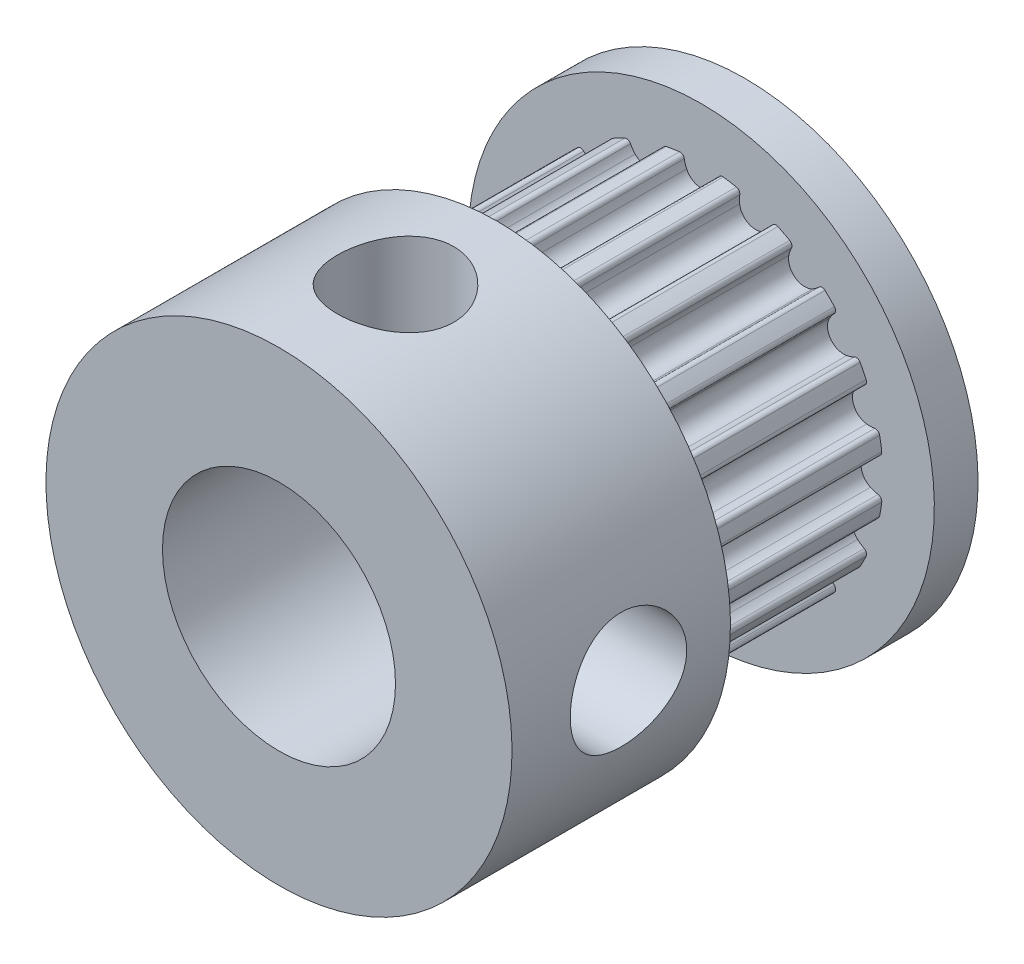
from build123d import *

# Parameters (mm, degrees)
CROQUIS1_R              = 6.366
SALIENTE_EXTRUIR1_DEPTH = 7
CORTAR_EXTRUIR1_DEPTH   = 12.404030516
MATRIZC1_COUNT          = 20
CROQUIS5_W              = 1.5
CROQUIS5_H              = 8
CROQUIS5_W_2            = 7.5
CROQUIS6_R              = 4
CORTAR_EXTRUIR2_DEPTH   = 20.595917942
CROQUIS8_R              = 2
CORTAR_EXTRUIR3_DEPTH   = 19.391574158
CROQUIS9_R              = 2
CORTAR_EXTRUIR4_DEPTH   = 19.391574324


with BuildPart() as part:
    # Croquis1 → Saliente-Extruir1 (new body)
    with BuildSketch(Plane.XY):
        Circle(CROQUIS1_R)
    extrude(amount=SALIENTE_EXTRUIR1_DEPTH)

    # Croquis3 → Cortar-Extruir1 (cut, through all)
    with BuildSketch(Plane(origin=(0, 0, 0), x_dir=(-1, 0, 0), z_dir=(0, 0, -1))):
        with BuildLine():
            Line((-7.140411071, 45.082781216), (-0.995861804, 6.287623976))
            Line((-0.995861804, 6.287623976), (-0.975994627, 6.162187557))
            ThreePointArc((-0.975994627, 6.162187557), (-0.863064611, 6.179016142), (-0.749845546, 6.193775315))
            ThreePointArc((-0.749845546, 6.193775315), (-0.641504612, 6.164627299), (-0.583688192, 6.068478318))
            ThreePointArc((-0.583688192, 6.068478318), (-0.55273127, 5.93441999), (-0.503666473, 5.805879678))
            ThreePointArc((-0.503666473, 5.805879678), (0, 5.484), (0.503666473, 5.805879678))
            ThreePointArc((0.503666473, 5.805879678), (0.55273127, 5.93441999), (0.583688192, 6.068478318))
            ThreePointArc((0.583688192, 6.068478318), (0.641504612, 6.164627299), (0.749845546, 6.193775315))
            ThreePointArc((0.749845546, 6.193775315), (0.863064611, 6.179016142), (0.975994627, 6.162187557))
            Line((0.975994627, 6.162187557), (0.995861804, 6.287623976))
            Line((0.995861804, 6.287623976), (7.140411071, 45.082781216))
            Line((7.140411071, 45.082781216), (7.140411071, 123.640268725))
            Line((7.140411071, 123.640268725), (-7.140411071, 123.640268725))
            Line((-7.140411071, 123.640268725), (-7.140411071, 45.082781216))
        make_face()
    cortar_extruir1 = extrude(amount=-CORTAR_EXTRUIR1_DEPTH, mode=Mode.SUBTRACT)

    # MatrizC1: Cortar-Extruir1 ×20 about axis
    matrizc1_axis = Axis((0, 0, 0), (0, 0, 1))
    for i in range(1, MATRIZC1_COUNT):
        add(cortar_extruir1.rotate(matrizc1_axis, i * 360 / MATRIZC1_COUNT), mode=Mode.SUBTRACT)

    # Croquis5 → Revolución1 (revolve)
    with BuildSketch(Plane(origin=(0, 0, 0), x_dir=(0, 0, -1), z_dir=(1, 0, 0))):
        with Locations((0.75, 4)):
            Rectangle(CROQUIS5_W, CROQUIS5_H)
        with Locations((-10.75, 4)):
            Rectangle(CROQUIS5_W_2, CROQUIS5_H)
    revolve(axis=Axis((0, 0, 7), (0, 0, 1)))

    # Croquis6 → Cortar-Extruir2 (cut, through all)
    with BuildSketch(Plane.XY.offset(14.5)):
        Circle(CROQUIS6_R)
    extrude(amount=-CORTAR_EXTRUIR2_DEPTH, mode=Mode.SUBTRACT)

    # Croquis8 → Cortar-Extruir3 (cut, through all)
    with BuildSketch(Plane(origin=(0, 0, 0), x_dir=(1, 0, 0), z_dir=(0, 1, 0))):
        with Locations(Location((0, -10.5, 0), (0, 0, 90))):
            Circle(CROQUIS8_R)
    extrude(amount=CORTAR_EXTRUIR3_DEPTH, mode=Mode.SUBTRACT)

    # Croquis9 → Cortar-Extruir4 (cut, through all)
    with BuildSketch(Plane(origin=(0, 0, 0), x_dir=(0, 0, -1), z_dir=(1, 0, 0))):
        with Locations(Location((-10.5, 0, 0), (0, 0, 180))):
            Circle(CROQUIS9_R)
    extrude(amount=CORTAR_EXTRUIR4_DEPTH, mode=Mode.SUBTRACT)


solid = part.part
